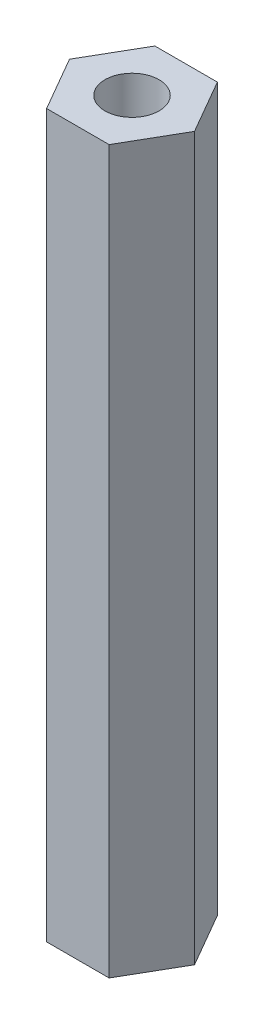
from build123d import *

# Parameters (mm, degrees)
BOSS_EXTRUDE1_DEPTH = 20
SKETCH2_R           = 1.5
CUT_EXTRUDE1_DEPTH  = 6


with BuildPart() as part:
    # Sketch1 → Boss-Extrude1 (new, symmetric)
    with BuildSketch(Plane(origin=(0, 0, 0), x_dir=(1, 0, 0), z_dir=(0, 1, 0))):
        Polygon((3.464101615, 0), (1.732050808, 3), (-1.732050808, 3), (-3.464101615, 0), (-1.732050808, -3), (1.732050808, -3), align=None)
    extrude(amount=BOSS_EXTRUDE1_DEPTH, both=True)

    # Sketch2 → Cut-Extrude1 (cut)
    with BuildSketch(Plane(origin=(0, 20, 0), x_dir=(1, 0, 0), z_dir=(0, 1, 0))):
        with Locations(Location((0, 0, 0), (0, 0, 270))):
            Circle(SKETCH2_R)
    cut_extrude1 = extrude(amount=-CUT_EXTRUDE1_DEPTH, mode=Mode.SUBTRACT)

    # Mirror1: Cut-Extrude1 across plane
    add(cut_extrude1.mirror(Plane.ZX), mode=Mode.SUBTRACT)


solid = part.part
